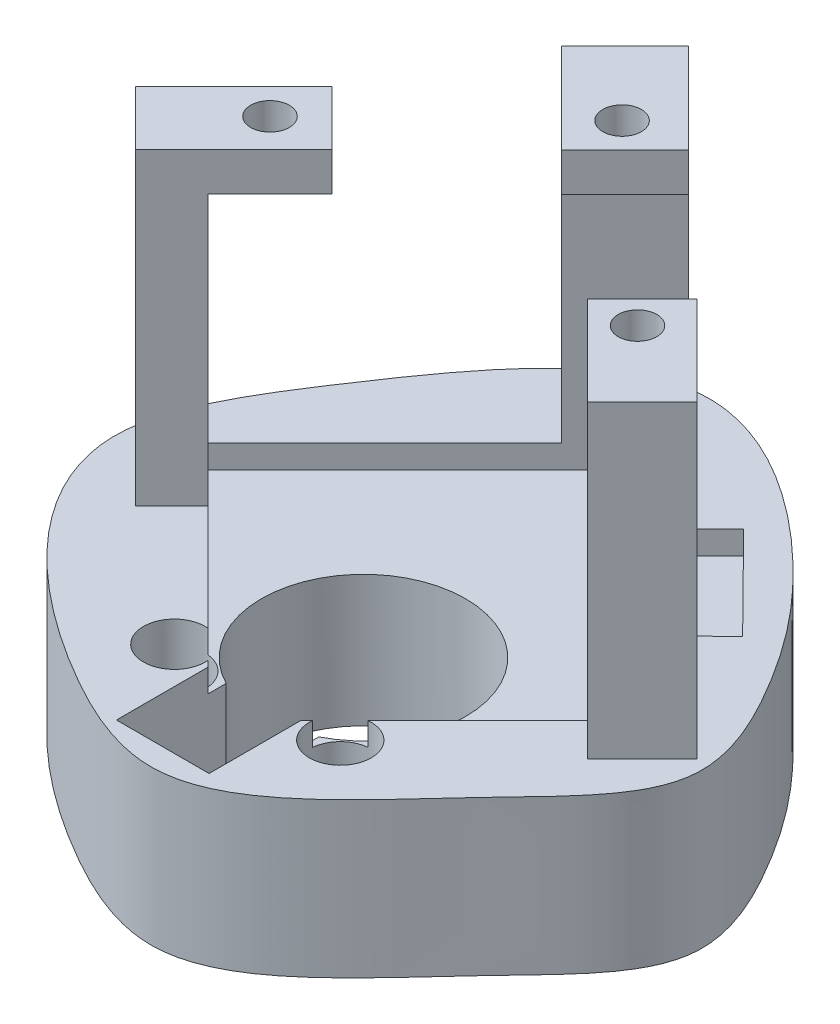
from build123d import *

# Parameters (mm, degrees)
BOSS_EXTRUDE1_DEPTH      = 10
BOSS_EXTRUDE1_DEPTH_BACK = 10
SKETCH2_R                = 60
SKETCH7_R                = 4
CUT_EXTRUDE2_DEPTH       = 15
CUT_EXTRUDE4_DEPTH       = 3
CUT_EXTRUDE5_DEPTH       = 3
BOSS_EXTRUDE2_DEPTH      = 35
BOSS_EXTRUDE3_DEPTH      = 5
SKETCH13_R               = 2.5
CUT_EXTRUDE7_DEPTH       = 5
SKETCH15_R               = 2.5
CUT_EXTRUDE8_DEPTH       = 5
SKETCH14_R               = 2.5
CUT_EXTRUDE9_DEPTH       = 5
SKETCH16_R               = 60
CUT_EXTRUDE10_DEPTH      = 38
SKETCH4_R                = 13.225
CUT_EXTRUDE12_DEPTH      = 42
SKETCH19_W               = 12
SKETCH19_H               = 20
CUT_EXTRUDE13_DEPTH      = 17


with BuildPart() as part:
    # Sketch2 → Boss-Extrude1 (new, two sides: drawn at the far end of the back side and taken through both)
    with BuildSketch(Plane(origin=(0, 0, 0), x_dir=(1, 0, 0), z_dir=(0, 1, 0)).offset(-BOSS_EXTRUDE1_DEPTH_BACK)):
        Circle(SKETCH2_R)
    extrude(amount=BOSS_EXTRUDE1_DEPTH + BOSS_EXTRUDE1_DEPTH_BACK)

    # Sketch7 → Cut-Extrude2 (cut)
    with BuildSketch(Plane(origin=(0, 10, 0), x_dir=(1, 0, 0), z_dir=(0, 1, 0))):
        with Locations((-10.75, -7.75)):
            Circle(SKETCH7_R)
    cut_extrude2 = extrude(amount=-CUT_EXTRUDE2_DEPTH, mode=Mode.SUBTRACT)

    # Mirror1: Cut-Extrude2 across plane
    add(cut_extrude2.mirror(Plane(origin=(0, 0, 0), x_dir=(0, 0, 1), z_dir=(1, 0, 0))), mode=Mode.SUBTRACT)

    # Sketch9 → Cut-Extrude4 (cut)
    with BuildSketch(Plane(origin=(0, 10, 0), x_dir=(1, 0, 0), z_dir=(0, 1, 0))):
        Polygon((-31.112706744, 17), (-8.372e-06, 48.112698372), (31.11269, 17), (-8.372e-06, -14.112698372), align=None)
    extrude(amount=-CUT_EXTRUDE4_DEPTH, mode=Mode.SUBTRACT)

    # Sketch6 → Cut-Extrude5 (cut)
    with BuildSketch(Plane(origin=(0, 10, 0), x_dir=(1, 0, 0), z_dir=(0, 1, 0))):
        Polygon((-5.977874391, 23.042765738), (5.977874391, 10.957234262), (25.17254203, 29.945776443), (13.216793249, 42.03130792), align=None)
    extrude(amount=-CUT_EXTRUDE5_DEPTH, mode=Mode.SUBTRACT)

    # Sketch11 → Boss-Extrude2 (add)
    with BuildSketch(Plane(origin=(0, 10, 0), x_dir=(1, 0, 0), z_dir=(0, 1, 0))):
        Polygon((-8.372e-06, 48.112698372), (-8.240017503, 39.872689242), (-12.799306685, 44.431978425), (-4.559297555, 52.671987555), align=None)
        Polygon((-31.112706744, 17), (-24.041638933, 9.928932188), (-28.755220541, 5.21535058), (-35.826288353, 12.286418392), align=None)
        Polygon((31.644591703, 17.531901703), (24.573523891, 10.460833891), (28.864455193, 6.169902588), (35.935523005, 13.2409704), align=None)
    extrude(amount=BOSS_EXTRUDE2_DEPTH)

    # Sketch12 → Boss-Extrude3 (add)
    with BuildSketch(Plane(origin=(0, 45, 0), x_dir=(1, 0, 0), z_dir=(0, 1, 0))):
        Polygon((-4.559297555, 52.671987555), (-12.799306685, 44.431978425), (-1.132044796, 32.764716535), (7.107964335, 41.004725665), align=None)
        Polygon((-35.826288353, 12.286418392), (-28.755220541, 5.21535058), (-16.027298479, 17.943272641), (-23.098366291, 25.014340453), align=None)
        Polygon((35.935523005, 13.2409704), (28.864455193, 6.169902588), (17.266701717, 17.767656064), (24.337769529, 24.838723876), align=None)
    extrude(amount=BOSS_EXTRUDE3_DEPTH)

    # Sketch13 → Cut-Extrude7 (cut)
    with BuildSketch(Plane(origin=(0, 50, 0), x_dir=(1, 0, 0), z_dir=(0, 1, 0))):
        with Locations((-0.5, 40)):
            Circle(SKETCH13_R)
    extrude(amount=-CUT_EXTRUDE7_DEPTH, mode=Mode.SUBTRACT)

    # Sketch15 → Cut-Extrude8 (cut)
    with BuildSketch(Plane(origin=(0, 50, 0), x_dir=(1, 0, 0), z_dir=(0, 1, 0))):
        with Locations((-23.777002133, 17.668993601)):
            Circle(SKETCH15_R)
    extrude(amount=-CUT_EXTRUDE8_DEPTH, mode=Mode.SUBTRACT)

    # Sketch14 → Cut-Extrude9 (cut)
    with BuildSketch(Plane(origin=(0, 50, 0), x_dir=(1, 0, 0), z_dir=(0, 1, 0))):
        with Locations((23.5, 18)):
            Circle(SKETCH14_R)
    extrude(amount=-CUT_EXTRUDE9_DEPTH, mode=Mode.SUBTRACT)

    # Sketch16 → Cut-Extrude10 (cut)
    with BuildSketch(Plane(origin=(0, 10, 0), x_dir=(1, 0, 0), z_dir=(0, 1, 0))):
        Circle(SKETCH16_R)
        with BuildLine():
            add(Edge.make_bspline(
                [(-4.79445414, 54.411479542), (3.711953261, 55.123778385), (20.176812176, 43.163893552), (32.095851639, 27.739664068), (41.103501035, 9.384731909), (23.441378071, -7.012281145), (7.387216057, -27.669539214), (-20.675561177, -15.265601832), (-45.215914175, 6.863059518), (-27.534475147, 35.312307502), (-14.416385352, 53.60577037), (-4.79445414, 54.411479542)],
                knots=[0, 0, 0, 0, 0.129983166, 0.216069769, 0.283536175, 0.368923683, 0.507401419, 0.580069943, 0.753753629, 0.852970941, 1, 1, 1, 1], degree=3))
        make_face(mode=Mode.SUBTRACT)
    extrude(amount=-CUT_EXTRUDE10_DEPTH, mode=Mode.SUBTRACT)

    # Sketch4 → Cut-Extrude12 (cut)
    with BuildSketch(Plane(origin=(0, 10, 0), x_dir=(1, 0, 0), z_dir=(0, 1, 0))):
        with Locations((0, 6)):
            Circle(SKETCH4_R)
    extrude(amount=-CUT_EXTRUDE12_DEPTH, mode=Mode.SUBTRACT)

    # Sketch19 → Cut-Extrude13 (cut)
    with BuildSketch(Plane(origin=(0, 10, 0), x_dir=(1, 0, 0), z_dir=(0, 1, 0))):
        with Locations((0, -10)):
            Rectangle(SKETCH19_W, SKETCH19_H)
    extrude(amount=-CUT_EXTRUDE13_DEPTH, mode=Mode.SUBTRACT)


solid = part.part
